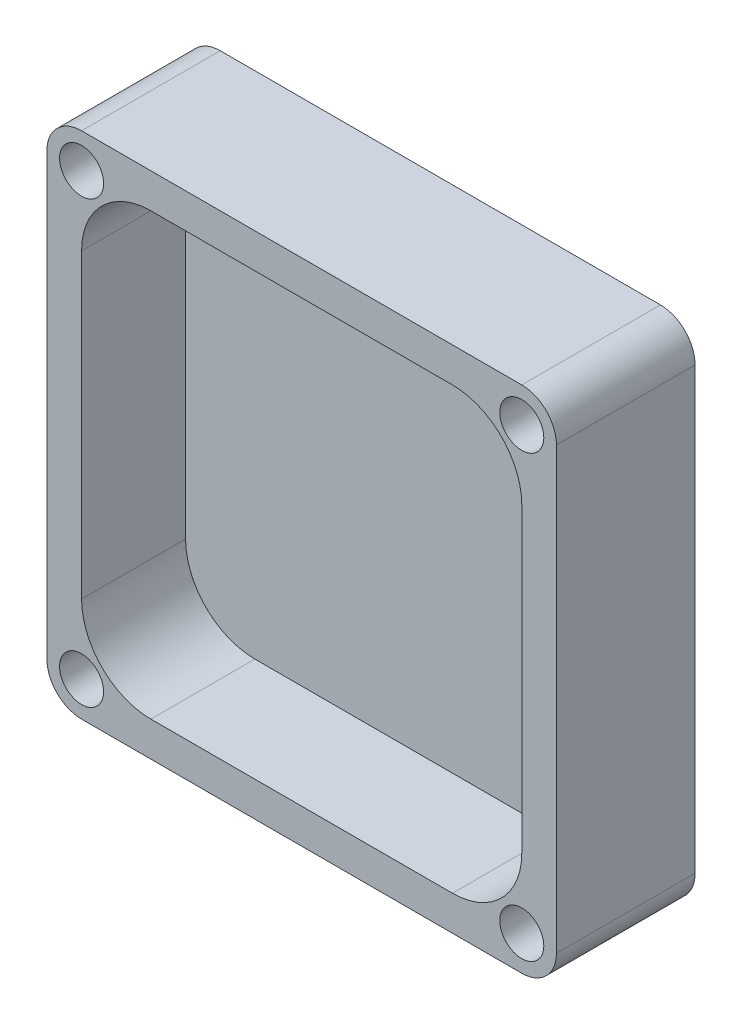
from build123d import *

# Parameters (mm, degrees)
SKETCH1_W           = 147
SKETCH1_H           = 147
SKETCH1_R           = 6.35
BOSS_EXTRUDE1_DEPTH = 10
SKETCH2_W           = 147
SKETCH2_H           = 147
SKETCH2_R           = 6.35
BOSS_EXTRUDE2_DEPTH = 30
FILLET1_R           = 10


with BuildPart() as part:
    # Sketch1 → Boss-Extrude1 (new body)
    with BuildSketch(Plane.XY):
        Rectangle(SKETCH1_W, SKETCH1_H)
        with Locations((-63.5, 63.5)):
            Circle(SKETCH1_R, mode=Mode.SUBTRACT)
        with Locations((63.5, 63.5)):
            Circle(SKETCH1_R, mode=Mode.SUBTRACT)
        with Locations((63.5, -63.5)):
            Circle(SKETCH1_R, mode=Mode.SUBTRACT)
        with Locations((-63.5, -63.5)):
            Circle(SKETCH1_R, mode=Mode.SUBTRACT)
    extrude(amount=BOSS_EXTRUDE1_DEPTH)

    # Sketch2 → Boss-Extrude2 (add)
    with BuildSketch(Plane.XY.offset(10)):
        Rectangle(SKETCH2_W, SKETCH2_H)
        with Locations((-63.5, -63.5)):
            Circle(SKETCH2_R, mode=Mode.SUBTRACT)
        with Locations((63.5, -63.5)):
            Circle(SKETCH2_R, mode=Mode.SUBTRACT)
        with Locations((63.5, 63.5)):
            Circle(SKETCH2_R, mode=Mode.SUBTRACT)
        with Locations((-63.5, 63.5)):
            Circle(SKETCH2_R, mode=Mode.SUBTRACT)
        with BuildLine():
            Line((-43.5, -63.5), (43.5, -63.5))
            ThreePointArc((43.5, -63.5), (57.642135624, -57.642135624), (63.5, -43.5))
            Line((63.5, -43.5), (63.5, 43.5))
            ThreePointArc((63.5, 43.5), (57.642135624, 57.642135624), (43.5, 63.5))
            Line((43.5, 63.5), (-43.5, 63.5))
            ThreePointArc((-43.5, 63.5), (-57.642135624, 57.642135624), (-63.5, 43.5))
            Line((-63.5, 43.5), (-63.5, -43.5))
            ThreePointArc((-63.5, -43.5), (-57.642135624, -57.642135624), (-43.5, -63.5))
        make_face(mode=Mode.SUBTRACT)
    extrude(amount=BOSS_EXTRUDE2_DEPTH)

    # Fillet1
    fillet1_edges = [part.edges().sort_by_distance(p)[0] for p in [
        (-73.5, -73.5, 20),
        (-73.5, 73.5, 20),
        (73.5, 73.5, 20),
        (73.5, -73.5, 20),
    ]]
    fillet(fillet1_edges, radius=FILLET1_R)


solid = part.part
